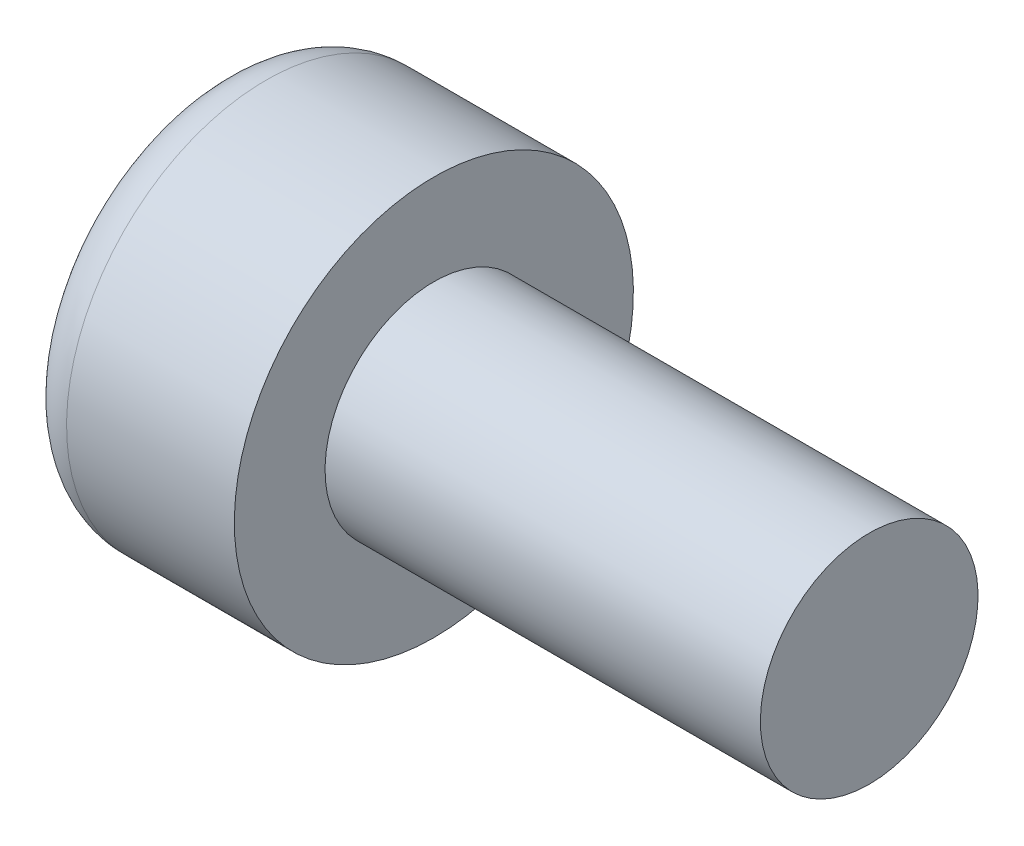
from build123d import *

# Parameters (mm, degrees)
CUT_EXTRUDE1_DEPTH = 1.5


with BuildPart() as part:
    # Sketch1 → Revolve1 (revolve)
    with BuildSketch(Plane.XY, mode=Mode.PRIVATE) as revolve1_sk:
        with BuildLine():
            Line((0, 0), (0, 2.0625))
            ThreePointArc((0, 2.0625), (0.201364088, 2.548635912), (0.6875, 2.75))
            Line((0.6875, 2.75), (3, 2.75))
            Line((3, 2.75), (3, 1.5))
            Line((3, 1.5), (9, 1.5))
            Line((9, 1.5), (9, 0))
            Line((9, 0), (0, 0))
        make_face()
    revolve(revolve1_sk.sketch.rotate(Axis((0, 0, 0), (1, 0, 0)), 180), axis=Axis((0, 0, 0), (1, 0, 0)))

    # Sketch2 → Cut-Extrude1 (cut)
    with BuildSketch(Plane.ZY):
        Polygon((0, 1.443375673), (-1.25, 0.721687836), (-1.25, -0.721687836), (0, -1.443375673), (1.25, -0.721687836), (1.25, 0.721687836), align=None)
    extrude(amount=-CUT_EXTRUDE1_DEPTH, mode=Mode.SUBTRACT)


solid = part.part
